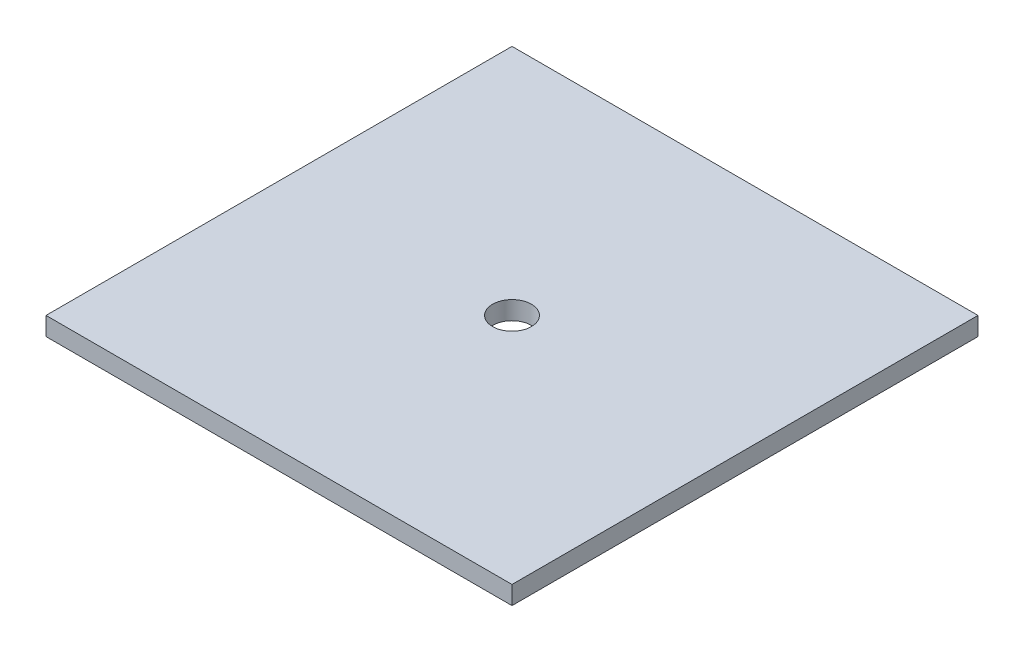
from build123d import *

# Parameters (mm, degrees)
SKETCH1_W           = 76.2
SKETCH1_H           = 76.2
SKETCH1_R           = 5
SKETCH1_R_2         = 3.175
BOSS_EXTRUDE1_DEPTH = 3


with BuildPart() as part:
    # Sketch1 → Boss-Extrude1 (new body)
    # profile 1 of 5: a face of its own
    with BuildSketch(Plane(origin=(0, 0, 0), x_dir=(1, 0, 0), z_dir=(0, 1, 0))):
        Rectangle(SKETCH1_W, SKETCH1_H)
        with Locations((31.730846191, 31.730846191)):
            Circle(SKETCH1_R, mode=Mode.SUBTRACT)
        with Locations((-31.730846191, 31.730846191)):
            Circle(SKETCH1_R, mode=Mode.SUBTRACT)
        with Locations((-31.730846191, -31.730846191)):
            Circle(SKETCH1_R, mode=Mode.SUBTRACT)
        with Locations((31.730846191, -31.730846191)):
            Circle(SKETCH1_R, mode=Mode.SUBTRACT)
        with Locations(Location((0, 0, 0), (0, 0, 270))):
            Circle(SKETCH1_R_2, mode=Mode.SUBTRACT)
    # profile 2 of 5: a face of its own
    with BuildSketch(Plane(origin=(0, 0, 0), x_dir=(1, 0, 0), z_dir=(0, 1, 0))):
        with Locations((-31.730846191, 31.730846191)):
            Circle(SKETCH1_R)
    # profile 3 of 5: a face of its own
    with BuildSketch(Plane(origin=(0, 0, 0), x_dir=(1, 0, 0), z_dir=(0, 1, 0))):
        with Locations((31.730846191, 31.730846191)):
            Circle(SKETCH1_R)
    # profile 4 of 5: a face of its own
    with BuildSketch(Plane(origin=(0, 0, 0), x_dir=(1, 0, 0), z_dir=(0, 1, 0))):
        with Locations((31.730846191, -31.730846191)):
            Circle(SKETCH1_R)
    # profile 5 of 5: a face of its own
    with BuildSketch(Plane(origin=(0, 0, 0), x_dir=(1, 0, 0), z_dir=(0, 1, 0))):
        with Locations((-31.730846191, -31.730846191)):
            Circle(SKETCH1_R)
    extrude(amount=BOSS_EXTRUDE1_DEPTH)


solid = part.part
